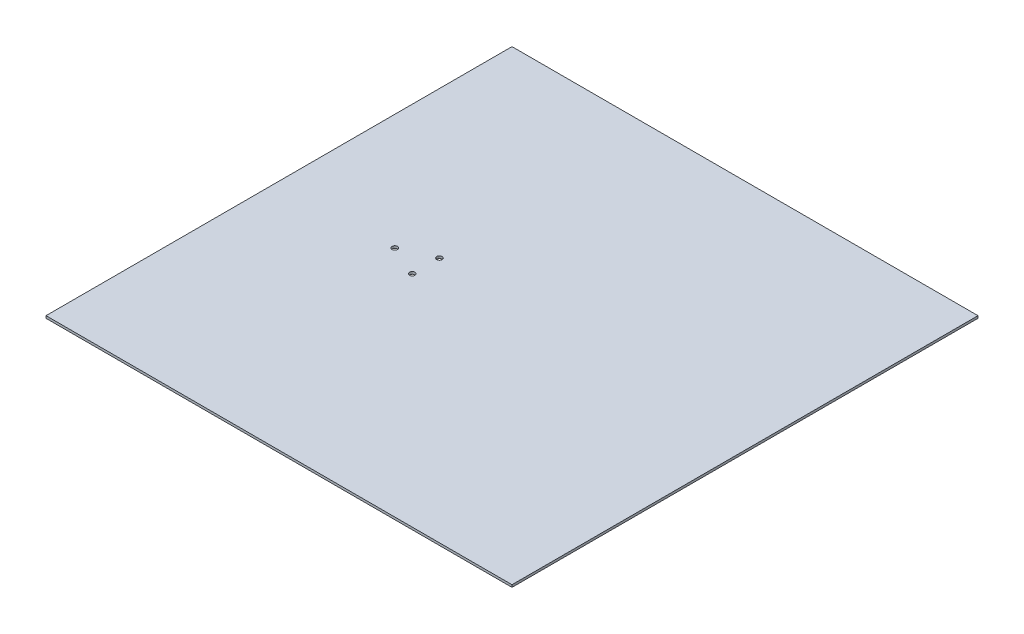
from build123d import *

# Parameters (mm, degrees)
SKETCH1_W               = 600
SKETCH1_H               = 600
BOSS_EXTRUDE1_DEPTH     = 3
CUT_EXTRUDE1_DEPTH      = 425.274675181
CUT_EXTRUDE1_DEPTH_BACK = 425.274675181
SKETCH2_R               = 3.5
CUT_EXTRUDE2_DEPTH      = 425.274675181
CUT_EXTRUDE2_DEPTH_BACK = 425.274675181
SKETCH3_R               = 3.55


with BuildPart() as part:
    # Sketch1 → Boss-Extrude1 (new body)
    with BuildSketch(Plane(origin=(0, 0, 0), x_dir=(1, 0, 0), z_dir=(0, 1, 0))):
        Rectangle(SKETCH1_W, SKETCH1_H)
    extrude(amount=BOSS_EXTRUDE1_DEPTH)

    # Sketch2 → Cut-Extrude1 (cut, two sides: drawn at the far end of the back side and taken through both)
    with BuildSketch(Plane(origin=(0, 3, 0), x_dir=(1, 0, 0), z_dir=(0, 1, 0)).offset(-CUT_EXTRUDE1_DEPTH_BACK)):
        with Locations(Location((-110.928868976, -17.5, 0), (0, 0, 270))):
            Circle(SKETCH2_R)
        with Locations(Location((-110.928868976, 17.5, 0), (0, 0, 270))):
            Circle(SKETCH2_R)
    extrude(amount=CUT_EXTRUDE1_DEPTH + CUT_EXTRUDE1_DEPTH_BACK, mode=Mode.SUBTRACT)

    # Sketch3 → Cut-Extrude2 (cut, two sides: drawn at the far end of the back side and taken through both)
    with BuildSketch(Plane(origin=(0, 3, 0), x_dir=(1, 0, 0), z_dir=(0, 1, 0)).offset(-CUT_EXTRUDE2_DEPTH_BACK)):
        with Locations(Location((-150.928868976, 0, 0), (0, 0, 270))):
            Circle(SKETCH3_R)
    extrude(amount=CUT_EXTRUDE2_DEPTH + CUT_EXTRUDE2_DEPTH_BACK, mode=Mode.SUBTRACT)


solid = part.part
